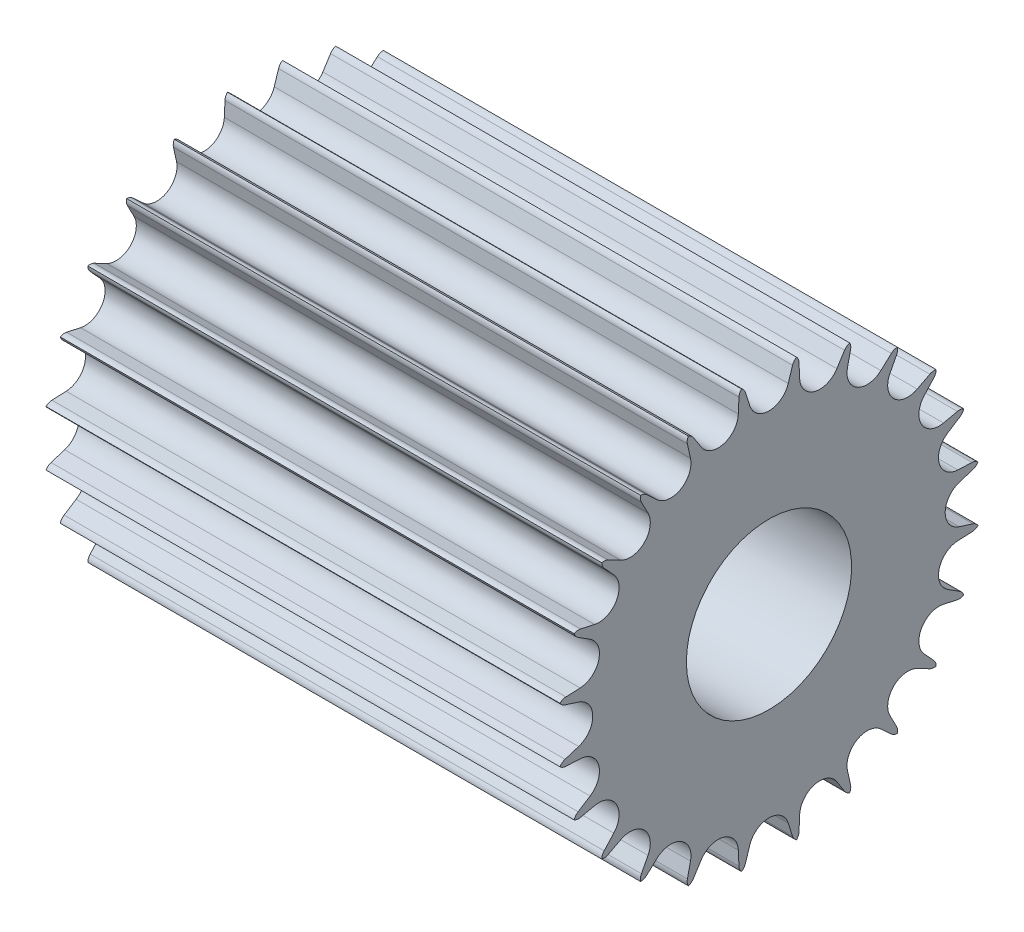
from build123d import *

# Parameters (mm, degrees)
CHAMFER_1_SIZE           = 1
SKETCH_4_W               = 2
SKETCH_4_H               = 1.208712153
CUT_EXTRUDE_1_DEPTH      = 33.451810427
CUT_EXTRUDE_2_REACH      = 34.452
PATTERN_CIRCULAR_3_COUNT = 24


with BuildPart() as part:
    # 草图1 → 旋转1 (revolve)
    with BuildSketch(Plane.XY):
        Polygon((0, 2.5), (0, 11.6), (28, 11.6), (28, 4.5), (20, 4.5), (20, 2.5), align=None)
    revolve(axis=Axis((0, 0, 0), (1, 0, 0)))

    # 倒角1
    chamfer_1_edges = [part.edges().sort_by_distance(p)[0] for p in [
        (20, -2.5, 0),
        (0, -2.5, 0),
    ]]
    chamfer(chamfer_1_edges, length=CHAMFER_1_SIZE)

    # 草图4 → 切除-拉伸1 (cut, through all)
    with BuildSketch(Plane.ZY):
        with Locations((0, 2.895643923)):
            Rectangle(SKETCH_4_W, SKETCH_4_H)
    extrude(amount=-CUT_EXTRUDE_1_DEPTH, mode=Mode.SUBTRACT)

    # 草图6 → 切除-拉伸2 (cut, up to next)
    with BuildSketch(Plane(origin=(0, 0, 0), x_dir=(0, 0, -1), z_dir=(1, 0, 0)), mode=Mode.PRIVATE) as cut_extrude_2_sk1:
        with BuildLine():
            Line((1.282657956, 11.110010829), (1.049088646, 10.369223621))
            ThreePointArc((1.049088646, 10.369223621), (0, 9.6), (-1.049088646, 10.369223621))
            Line((-1.049088646, 10.369223621), (-1.282657956, 11.110010829))
            ThreePointArc((-1.282657956, 11.110010829), (-1.496857499, 11.385110965), (-1.838773928, 11.453336215))
            ThreePointArc((-1.838773928, 11.453336215), (-2.085185987, 11.411047253), (-2.330629413, 11.363457508))
            Line((-2.330629413, 11.363457508), (-2.815847343, 12.902372174))
            ThreePointArc((-2.815847343, 12.902372174), (0, 13.206066938), (2.815847343, 12.902372174))
            Line((2.815847343, 12.902372174), (2.330629413, 11.363457508))
            ThreePointArc((2.330629413, 11.363457508), (2.085185987, 11.411047253), (1.838773928, 11.453336215))
            ThreePointArc((1.838773928, 11.453336215), (1.496857499, 11.385110965), (1.282657956, 11.110010829))
        make_face()
    cut_extrude_2_tool1 = extrude(cut_extrude_2_sk1.sketch, amount=CUT_EXTRUDE_2_REACH, mode=Mode.PRIVATE) & part.part
    cut_extrude_2 = cut_extrude_2_tool1.solids().sort_by_distance((0, 11.799996, 0))[0]
    add(cut_extrude_2, mode=Mode.SUBTRACT)

    # 阵列(圆周)3: 切除-拉伸2 ×24 about axis
    pattern_circular_3_axis = Axis((-1.4, 0, 0), (1, 0, 0))
    for i in range(1, PATTERN_CIRCULAR_3_COUNT):
        add(cut_extrude_2.rotate(pattern_circular_3_axis, i * 360 / PATTERN_CIRCULAR_3_COUNT), mode=Mode.SUBTRACT)


solid = part.part
